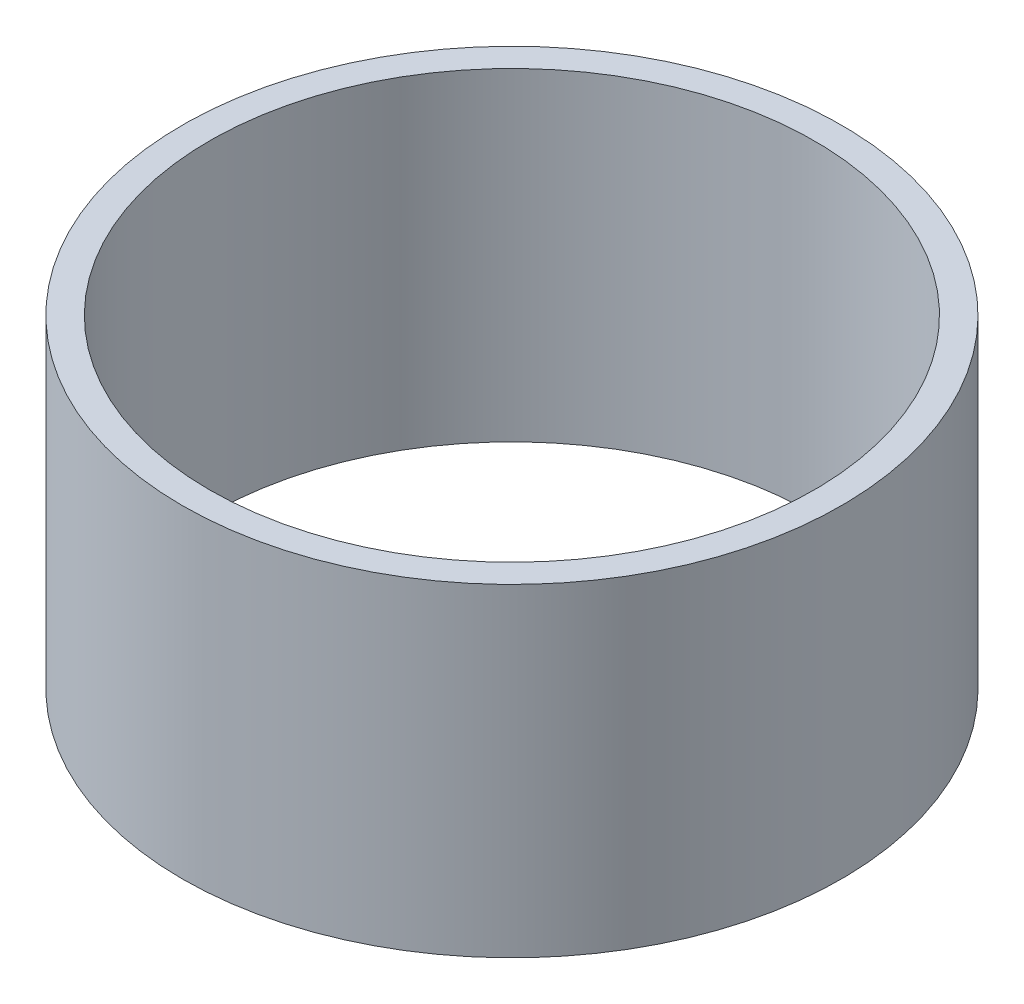
from build123d import *

# Parameters (mm, degrees)
SKETCH1_R           = 15.15757818
SKETCH1_R_2         = 13.9065
BOSS_EXTRUDE1_DEPTH = 14.8717


with BuildPart() as part:
    # Sketch1 → Boss-Extrude1 (new body)
    with BuildSketch(Plane(origin=(0, 0, 0), x_dir=(1, 0, 0), z_dir=(0, 1, 0))):
        with Locations(Location((0, 0, 0), (0, 0, 270))):
            Circle(SKETCH1_R)
        with Locations(Location((0, 0, 0), (0, 0, 270))):
            Circle(SKETCH1_R_2, mode=Mode.SUBTRACT)
    extrude(amount=BOSS_EXTRUDE1_DEPTH)


solid = part.part
